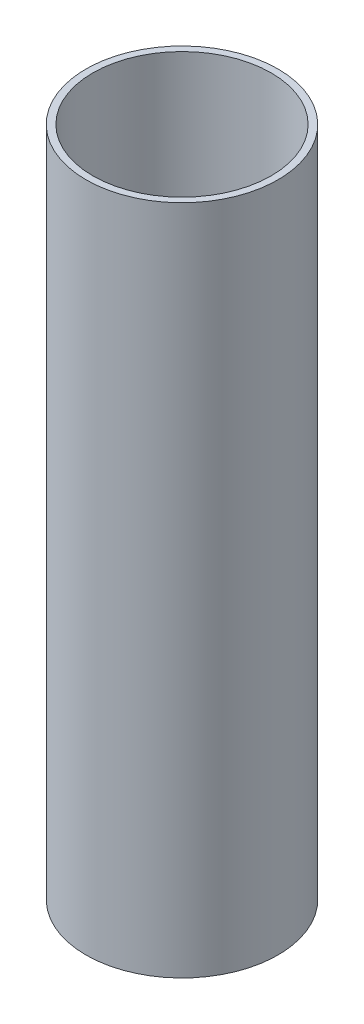
from build123d import *

# Parameters (mm, degrees)
SKETCH1_W = 1.8034
SKETCH1_H = 177.8


with BuildPart() as part:
    # Sketch1 → Revolve1 (revolve)
    with BuildSketch(Plane.XY, mode=Mode.PRIVATE) as revolve1_sk:
        with Locations((24.5237, 88.9)):
            Rectangle(SKETCH1_W, SKETCH1_H)
    revolve(revolve1_sk.sketch.rotate(Axis((0, -13.97, 0), (0, 1, 0)), 90), axis=Axis((0, -13.97, 0), (0, 1, 0)))


solid = part.part
